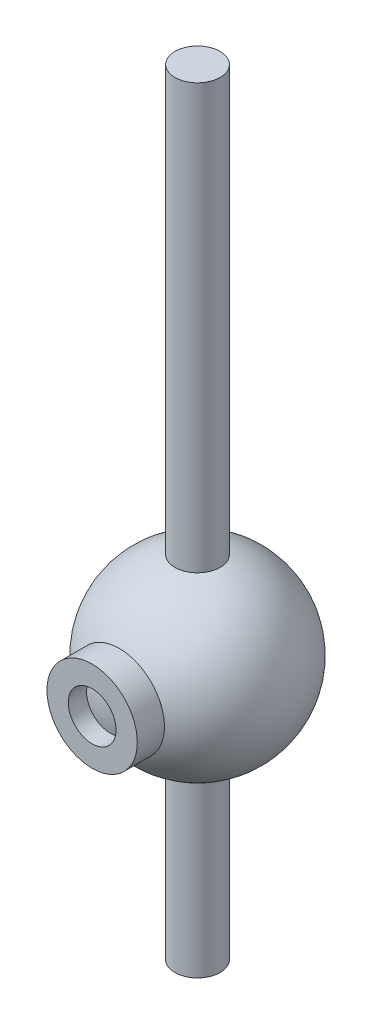
from build123d import *

# Parameters (mm, degrees)
BOSS_EXTRUDE1_START = 7
SKETCH1_R           = 6
SKETCH1_R_2         = 3.175
BOSS_EXTRUDE1_DEPTH = 7


with BuildPart() as part:
    # Sketch1 → Boss-Extrude1 (new body)
    with BuildSketch(Plane.XY.offset(BOSS_EXTRUDE1_START)):
        Circle(SKETCH1_R)
        Circle(SKETCH1_R_2, mode=Mode.SUBTRACT)
    extrude(amount=BOSS_EXTRUDE1_DEPTH)

    # Sketch2 → Revolve1 (revolve)
    with BuildSketch(Plane.XY, mode=Mode.PRIVATE) as revolve1_sk:
        with BuildLine():
            Line((0, -35), (3, -35))
            Line((3, -35), (3, -11.618950039))
            ThreePointArc((3, -11.618950039), (12, 0), (3, 11.618950039))
            Line((3, 11.618950039), (3, 68))
            Line((3, 68), (0, 68))
            Line((0, 68), (0, -35))
        make_face()
    revolve(revolve1_sk.sketch.rotate(Axis((0, -35, 0), (0, 1, 0)), 90), axis=Axis((0, -35, 0), (0, 1, 0)))


solid = part.part
